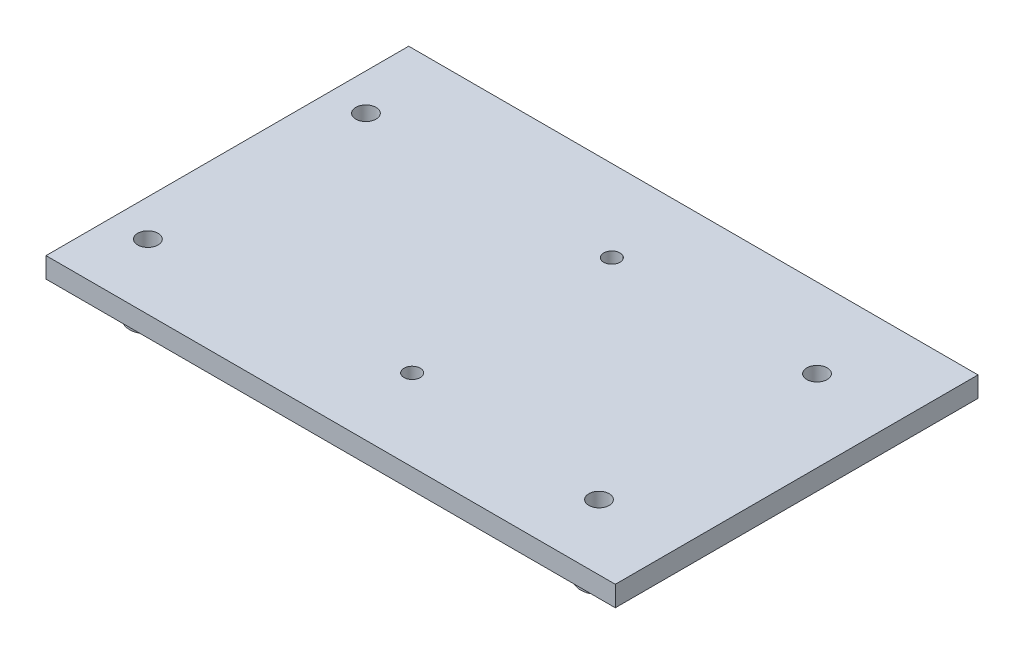
from build123d import *

# Parameters (mm, degrees)
SKETCH1_W           = 139.7
SKETCH1_H           = 89
BOSS_EXTRUDE1_DEPTH = 5
SKETCH4_R           = 4.5
SKETCH4_R_2         = 2.5
BOSS_EXTRUDE2_DEPTH = 12
SKETCH12_R          = 2
CUT_EXTRUDE1_DEPTH  = 5
CUT_EXTRUDE2_START  = -10
SKETCH13_R          = 2.5
CUT_EXTRUDE2_DEPTH  = 10


with BuildPart() as part:
    # Sketch1 → Boss-Extrude1 (new body)
    with BuildSketch(Plane(origin=(0, 0, 0), x_dir=(1, 0, 0), z_dir=(0, 1, 0))):
        with Locations((-0.18185994, 0.363719879)):
            Rectangle(SKETCH1_W, SKETCH1_H)
    extrude(amount=BOSS_EXTRUDE1_DEPTH)

    # Sketch4 → Boss-Extrude2 (add)
    # profile 1 of 4: a face of its own
    with BuildSketch(Plane.XZ):
        with Locations(Location((-61.03185994, 28.136280121, 0), (0, 0, 270))):
            Circle(SKETCH4_R)
        with Locations(Location((-61.03185994, 28.136280121, 0), (0, 0, 270))):
            Circle(SKETCH4_R_2, mode=Mode.SUBTRACT)
    # profile 2 of 4: a face of its own
    with BuildSketch(Plane.XZ):
        with Locations(Location((49.66814006, 28.136280121, 0), (0, 0, 270))):
            Circle(SKETCH4_R)
        with Locations(Location((49.66814006, 28.136280121, 0), (0, 0, 270))):
            Circle(SKETCH4_R_2, mode=Mode.SUBTRACT)
    # profile 3 of 4: a face of its own
    with BuildSketch(Plane.XZ):
        with Locations(Location((-61.03185994, -25.363719879, 0), (0, 0, 270))):
            Circle(SKETCH4_R)
        with Locations(Location((-61.03185994, -25.363719879, 0), (0, 0, 270))):
            Circle(SKETCH4_R_2, mode=Mode.SUBTRACT)
    # profile 4 of 4: a face of its own
    with BuildSketch(Plane.XZ):
        with Locations(Location((49.66814006, -25.363719879, 0), (0, 0, 270))):
            Circle(SKETCH4_R)
        with Locations(Location((49.66814006, -25.363719879, 0), (0, 0, 270))):
            Circle(SKETCH4_R_2, mode=Mode.SUBTRACT)
    extrude(amount=BOSS_EXTRUDE2_DEPTH)

    # Sketch12 → Cut-Extrude1 (cut)
    with BuildSketch(Plane.XZ):
        with Locations(Location((-0.18185994, 24.136280121, 0), (0, 0, 270))):
            Circle(SKETCH12_R)
        with Locations(Location((-0.18185994, -24.863719879, 0), (0, 0, 270))):
            Circle(SKETCH12_R)
    extrude(amount=-CUT_EXTRUDE1_DEPTH, mode=Mode.SUBTRACT)

    # Sketch13 → Cut-Extrude2 (cut)
    with BuildSketch(Plane.XZ.offset(CUT_EXTRUDE2_START)):
        with Locations(Location((-61.03185994, 28.136280121, 0), (0, 0, 270))):
            Circle(SKETCH13_R)
        with Locations(Location((-61.03185994, -25.363719879, 0), (0, 0, 270))):
            Circle(SKETCH13_R)
        with Locations(Location((49.66814006, -25.363719879, 0), (0, 0, 270))):
            Circle(SKETCH13_R)
        with Locations(Location((49.66814006, 28.136280121, 0), (0, 0, 270))):
            Circle(SKETCH13_R)
    extrude(amount=CUT_EXTRUDE2_DEPTH, mode=Mode.SUBTRACT)


solid = part.part
